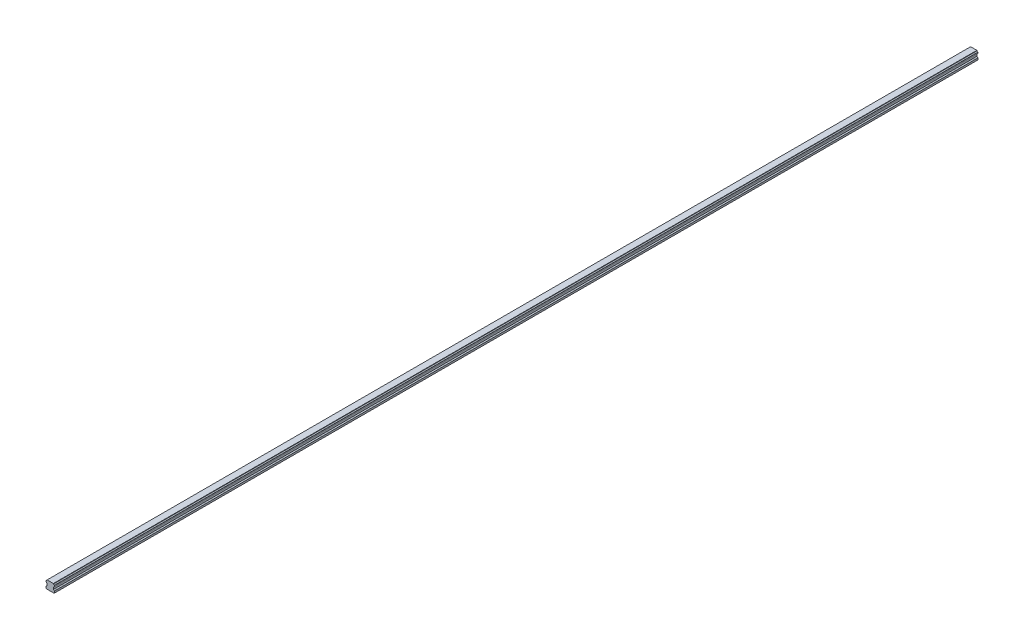
from build123d import *

# Parameters (mm, degrees)
EXTRUDE_1_DEPTH = 2500


with BuildPart() as part:
    # Model → Бобышка-Вытянуть1 (new body)
    with BuildSketch(Plane.XY):
        with BuildLine():
            Line((-11.5, -10), (-10.5, -11))
            Line((-10.5, -11), (10.5, -11))
            Line((10.5, -11), (11.5, -10))
            Line((11.5, -10), (11.5, -5))
            Line((11.5, -5), (8.5, -3))
            Line((8.5, -3), (8.5, 2))
            Line((8.5, 2), (9.007584586, 2.507584586))
            ThreePointArc((9.007584586, 2.507584586), (9.732233047, 4.080761184), (11.305409645, 4.805409645))
            Line((11.305409645, 4.805409645), (11.5, 5))
            Line((11.5, 5), (11.5, 8))
            Line((11.5, 8), (11.305409645, 8.194590355))
            ThreePointArc((11.305409645, 8.194590355), (9.732233047, 8.919238816), (9.007584586, 10.492415414))
            Line((9.007584586, 10.492415414), (8.5, 11))
            Line((8.5, 11), (-8.5, 11))
            Line((-8.5, 11), (-9.007584586, 10.492415414))
            ThreePointArc((-9.007584586, 10.492415414), (-9.732233047, 8.919238816), (-11.305409645, 8.194590355))
            Line((-11.305409645, 8.194590355), (-11.5, 8))
            Line((-11.5, 8), (-11.5, 5))
            Line((-11.5, 5), (-11.305409645, 4.805409645))
            ThreePointArc((-11.305409645, 4.805409645), (-9.732233047, 4.080761184), (-9.007584586, 2.507584586))
            Line((-9.007584586, 2.507584586), (-8.5, 2))
            Line((-8.5, 2), (-8.5, -3))
            Line((-8.5, -3), (-11.5, -5))
            Line((-11.5, -5), (-11.5, -10))
        make_face()
    extrude(amount=-EXTRUDE_1_DEPTH)


solid = part.part
